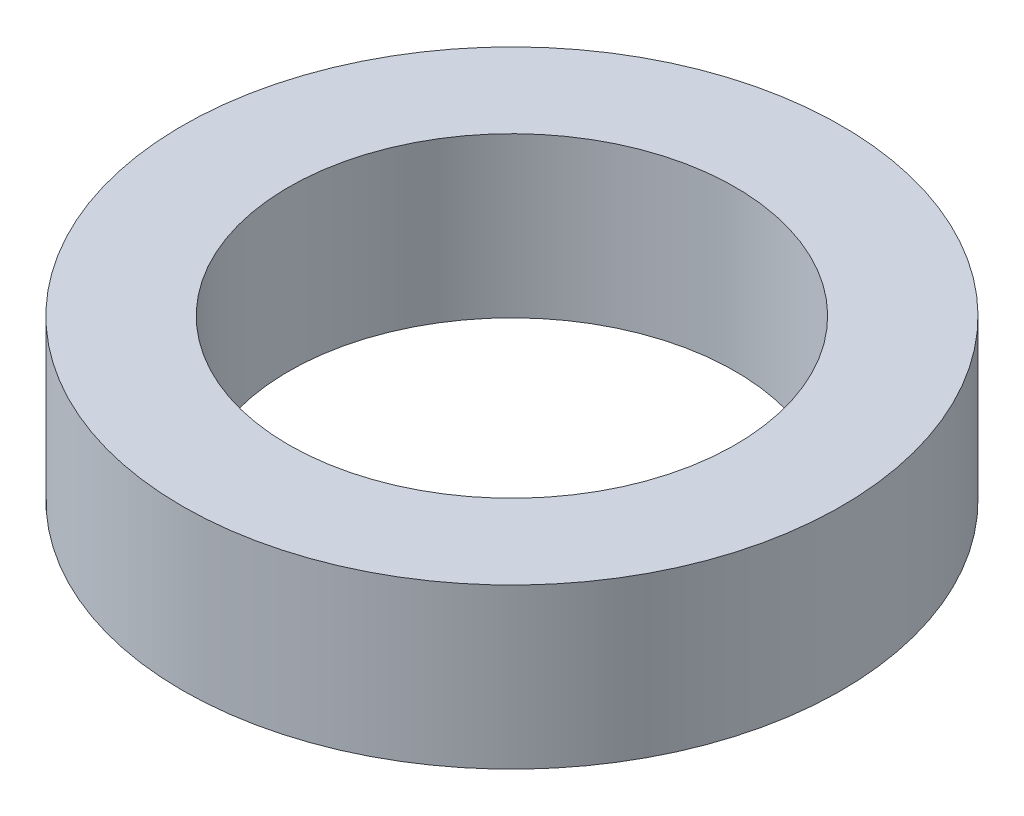
from build123d import *

# Parameters (mm, degrees)
SKETCH_1_R      = 3.1
SKETCH_1_R_2    = 2.1
EXTRUDE_1_DEPTH = 1.5


with BuildPart() as part:
    # 草图1 → 凸台-拉伸1 (new body)
    with BuildSketch(Plane(origin=(0, 0, 0), x_dir=(1, 0, 0), z_dir=(0, 1, 0))):
        with Locations(Location((0, 0, 0), (0, 0, 270))):
            Circle(SKETCH_1_R)
        with Locations(Location((0, 0, 0), (0, 0, 270))):
            Circle(SKETCH_1_R_2, mode=Mode.SUBTRACT)
    extrude(amount=EXTRUDE_1_DEPTH)


solid = part.part
